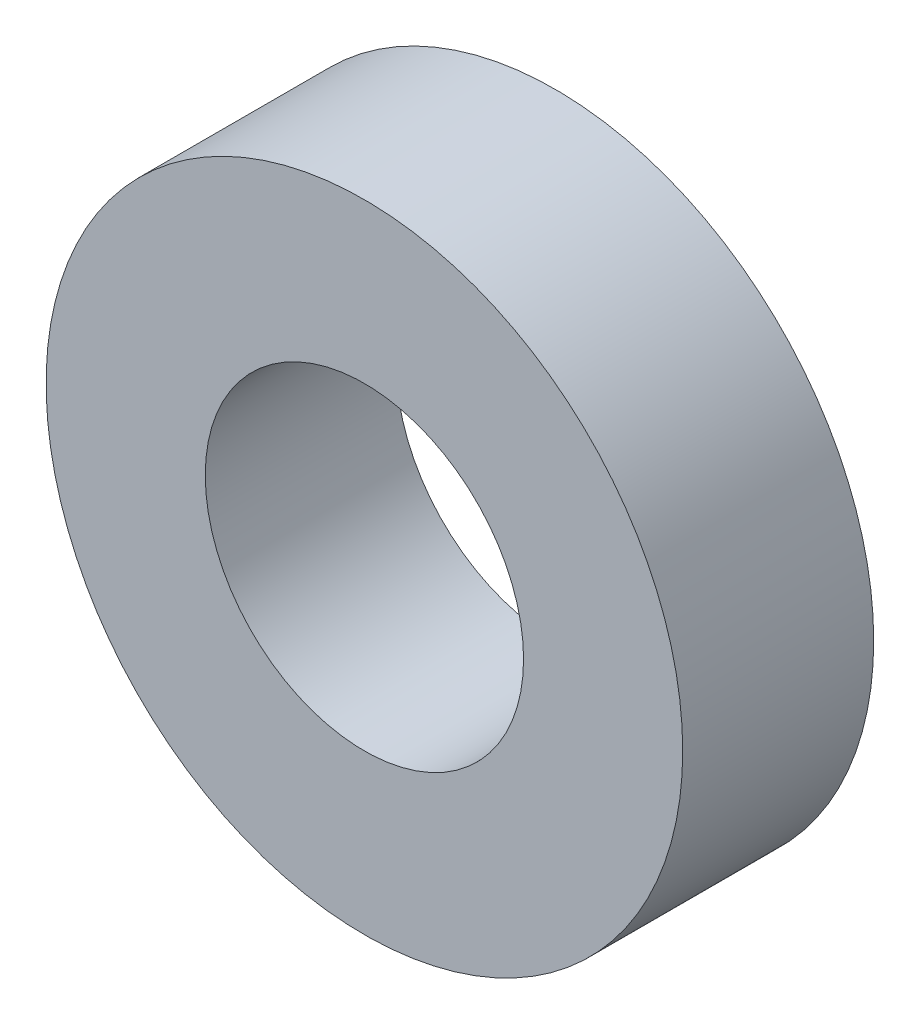
from build123d import *

# Parameters (mm, degrees)
CROQUIS1_R              = 5
SALIENTE_EXTRUIR1_DEPTH = 3
CORTAR_EXTRUIR1_REACH   = 9.681
CROQUIS2_R              = 2.5


with BuildPart() as part:
    # Croquis1 → Saliente-Extruir1 (new body)
    with BuildSketch(Plane.XY):
        Circle(CROQUIS1_R)
    extrude(amount=SALIENTE_EXTRUIR1_DEPTH)

    # Croquis2 → Cortar-Extruir1 (cut, up to next)
    with BuildSketch(Plane.XY.offset(3), mode=Mode.PRIVATE) as cortar_extruir1_sk1:
        Circle(CROQUIS2_R)
    cortar_extruir1_tool1 = extrude(cortar_extruir1_sk1.sketch, amount=-CORTAR_EXTRUIR1_REACH, mode=Mode.PRIVATE) & part.part
    add(cortar_extruir1_tool1.solids().sort_by_distance((0, 0, 3))[0], mode=Mode.SUBTRACT)


solid = part.part
